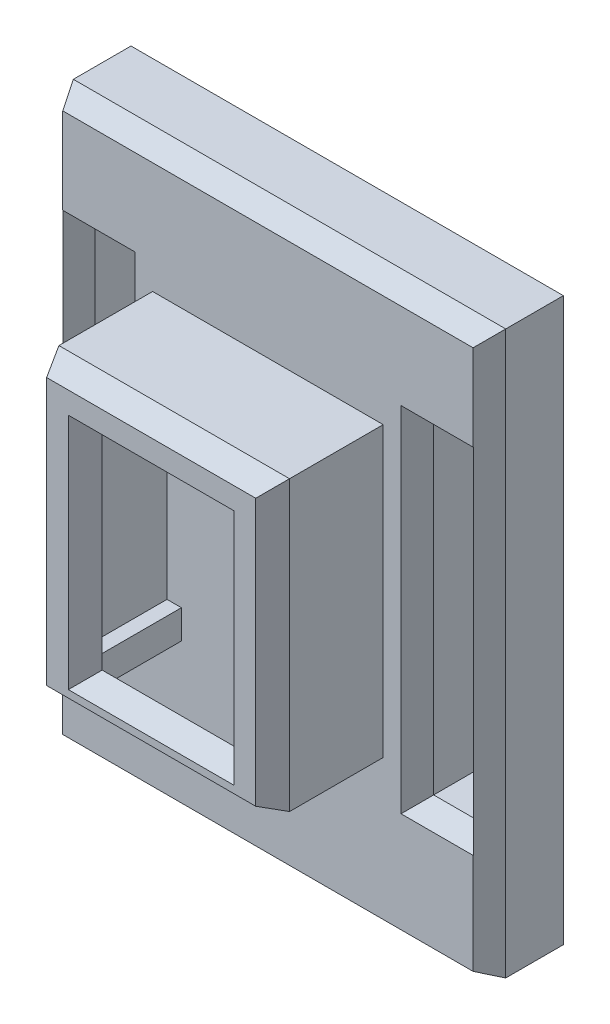
from build123d import *

# Parameters (mm, degrees)
ESBO_O1_W                = 6
ESBO_O1_H                = 6
ESBO_O1_H_2              = 1
ESBO_O1_H_3              = 1.5
RESSALTO_EXTRUS_O1_DEPTH = 4
ESBO_O2_W                = 30
ESBO_O2_H                = 39
ESBO_O2_W_2              = 3.5
ESBO_O2_H_2              = 23
RESSALTO_EXTRUS_O2_DEPTH = 1.5
RESSALTO_EXTRUS_O2_TAPER = 27
ESBO_O3_W                = 1
ESBO_O3_H                = 1
RESSALTO_EXTRUS_O3_DEPTH = 6.5
ESBO_O4_W                = 16
ESBO_O4_H                = 20
ESBO_O4_W_2              = 10
ESBO_O4_H_2              = 15
RESSALTO_EXTRUS_O4_DEPTH = 1.6
RESSALTO_EXTRUS_O4_DRAFT = 25


with BuildPart() as part:
    # Esboço1 → Ressalto-extrusão1 (new body)
    with BuildSketch(Plane.XY):
        Polygon((13.5, 25), (13.5, 19), (13.5, 0), (13.5, -4), (13.5, -11), (6, -11), (6, -12.5), (15, -12.5), (15, 0), (15, 26.5), (0, 26.5), (-15, 26.5), (-15, 0), (-15, -12.5), (-6, -12.5), (-6, -11), (-13.5, -11), (-13.5, -4), (-13.5, 0), (-13.5, 19), (-13.5, 25), (0, 25), align=None)
        Polygon((-10, 0), (-7.5, 0), (-7.5, 19), (-7.5, 24), (-12.5, 24), (-12.5, 19), (-10, 19), align=None)
        Polygon((7.5, 19), (7.5, 0), (10, 0), (10, 19), (12.5, 19), (12.5, 24), (7.5, 24), align=None)
        Polygon((7.5, 0), (0, 0), (-7.5, 0), (-10, 0), (-10, -4), (-6, -4), (0, -4), (6, -4), (10, -4), (10, 0), align=None)
        Polygon((-6, -4), (-10, -4), (-12.5, -4), (-12.5, -10), (-6, -10), align=None)
        Polygon((-12.5, -10), (-12.5, -4), (-13.5, -4), (-13.5, -11), (-6, -11), (-6, -10), align=None)
        Polygon((12.5, -4), (10, -4), (6, -4), (6, -10), (12.5, -10), align=None)
        Polygon((13.5, -4), (12.5, -4), (12.5, -10), (6, -10), (6, -11), (13.5, -11), align=None)
        with Locations((-3, -7)):
            Rectangle(ESBO_O1_W, ESBO_O1_H)
        with Locations((3, -7)):
            Rectangle(ESBO_O1_W, ESBO_O1_H)
        with Locations((3, -10.5)):
            Rectangle(ESBO_O1_W, ESBO_O1_H_2)
        with Locations((-3, -10.5)):
            Rectangle(ESBO_O1_W, ESBO_O1_H_2)
        with Locations((-3, -11.75)):
            Rectangle(ESBO_O1_W, ESBO_O1_H_3)
        with Locations((3, -11.75)):
            Rectangle(ESBO_O1_W, ESBO_O1_H_3)
    extrude(amount=RESSALTO_EXTRUS_O1_DEPTH)

    # Esboço2 → Ressalto-extrusão2 (add)
    with BuildSketch(Plane.XY.offset(4)):
        with Locations((0, 7)):
            Rectangle(ESBO_O2_W, ESBO_O2_H)
        with Locations((11.75, 7.5)):
            Rectangle(ESBO_O2_W_2, ESBO_O2_H_2, mode=Mode.SUBTRACT)
        with Locations((-11.75, 7.5)):
            Rectangle(ESBO_O2_W_2, ESBO_O2_H_2, mode=Mode.SUBTRACT)
    extrude(amount=RESSALTO_EXTRUS_O2_DEPTH, taper=RESSALTO_EXTRUS_O2_TAPER)

    # Esboço3 → Ressalto-extrusão3 (add)
    with BuildSketch(Plane.XY.offset(5.5)):
        Polygon((7, 16), (7, 0), (7, -1), (7, -2), (8, -2), (8, 18), (-8, 18), (-8, -2), (-7, -2), (-7, -1), (-7, 0), (-7, 16), (-7, 17), (-6, 17), (6, 17), (7, 17), align=None)
        with Locations((-6.5, -1.5)):
            Rectangle(ESBO_O3_W, ESBO_O3_H)
        with Locations((-6.5, -0.5)):
            Rectangle(ESBO_O3_W, ESBO_O3_H)
        with Locations((-6.5, 16.5)):
            Rectangle(ESBO_O3_W, ESBO_O3_H)
        with Locations((6.5, 16.5)):
            Rectangle(ESBO_O3_W, ESBO_O3_H)
        with Locations((6.5, -0.5)):
            Rectangle(ESBO_O3_W, ESBO_O3_H)
        with Locations((6.5, -1.5)):
            Rectangle(ESBO_O3_W, ESBO_O3_H)
    extrude(amount=RESSALTO_EXTRUS_O3_DEPTH)


with BuildPart() as ressalto_extrus_o4_tool:
    # Esboço4 → Ressalto-extrusão4 (with draft: the straight prism first)
    with BuildSketch(Plane.XY.offset(12)):
        with Locations((0, 8)):
            Rectangle(ESBO_O4_W, ESBO_O4_H)
        with Locations((0, 7.5)):
            Rectangle(ESBO_O4_W_2, ESBO_O4_H_2, mode=Mode.SUBTRACT)
    extrude(amount=RESSALTO_EXTRUS_O4_DEPTH)
    # Ressalto-extrusão4: the draft: its side faces are tilted about the plane it starts from
    ressalto_extrus_o4_sides = [ressalto_extrus_o4_tool.faces().sort_by_distance(p)[0] for p in [
        (-8, 8, 12.8),
        (0, -2, 12.8),
        (8, 8, 12.8),
        (0, 18, 12.8),
        (0, 15, 12.8),
        (5, 7.5, 12.8),
        (0, 0, 12.8),
        (-5, 7.5, 12.8),
    ]]
    draft(ressalto_extrus_o4_sides, Plane.XY.offset(12), RESSALTO_EXTRUS_O4_DRAFT)


with BuildPart() as part_1:
    add(part.part)

    # Ressalto-extrusão4: add ressalto_extrus_o4_tool
    add(ressalto_extrus_o4_tool.part)


solid = part_1.part
